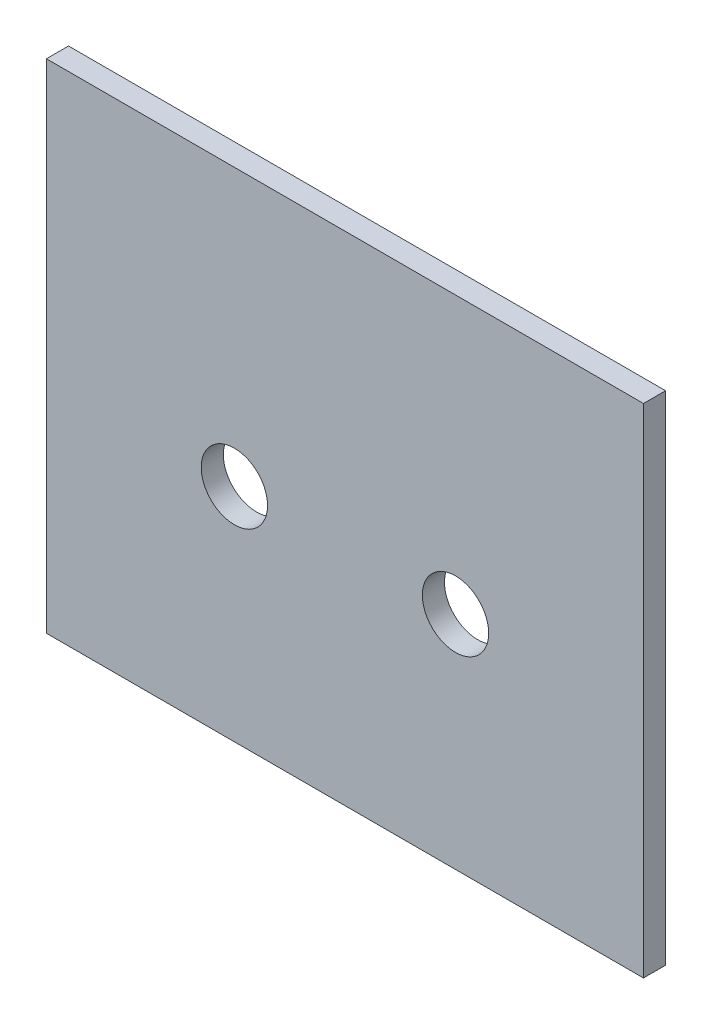
from build123d import *

# Parameters (mm, degrees)
BOSS_EXTRUDE1_DEPTH = 10


with BuildPart() as part:
    # Sketch1 → Boss-Extrude1 (new body)
    with BuildSketch(Plane.XY):
        with BuildLine():
            Line((0, 175), (0, 100))
            Line((0, 100), (70, 100))
            ThreePointArc((70, 100), (85, 115), (100, 100))
            Line((100, 100), (170, 100))
            ThreePointArc((170, 100), (185, 115), (200, 100))
            Line((200, 100), (270, 100))
            Line((270, 100), (270, 225))
            Line((270, 225), (0, 225))
            Line((0, 225), (0, 175))
        make_face()
        with BuildLine():
            Line((0, 100), (0, 0))
            Line((0, 0), (270, 0))
            Line((270, 0), (270, 100))
            Line((270, 100), (200, 100))
            ThreePointArc((200, 100), (185, 85), (170, 100))
            Line((170, 100), (100, 100))
            ThreePointArc((100, 100), (85, 85), (70, 100))
            Line((70, 100), (0, 100))
        make_face()
    extrude(amount=-BOSS_EXTRUDE1_DEPTH)


solid = part.part
